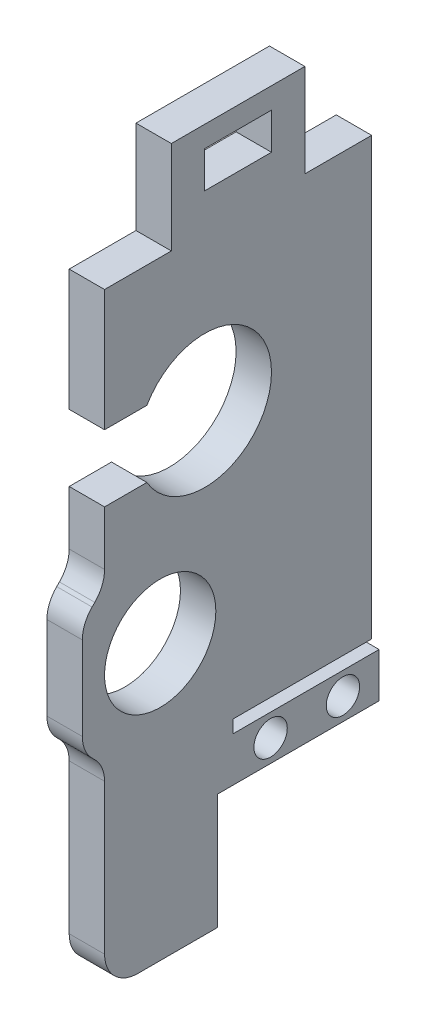
from build123d import *

# Parameters (mm, degrees)
BOSS_EXTRUDE1_DEPTH     = 3.18
SKETCH2_4_OUTSIDE_W     = 40.864
SKETCH2_4_OUTSIDE_H     = 68.924
SKETCH2_4_OUTSIDE_R     = 5
CUT_EXTRUDE2_DEPTH      = 3.18
FILLET6_R               = 3
M3_5X0_6_TAPPED_HOLE1_D = 3
SKETCH9_W               = 3.18
SKETCH9_H               = 12
BOSS_EXTRUDE2_DEPTH     = 8.36
SKETCH10_W              = 6
SKETCH10_H              = 3.28
CUT_EXTRUDE3_DEPTH      = 68.81643901


with BuildPart() as part:
    # Sketch2 → Boss-Extrude1 (new body)
    with BuildSketch(Plane(origin=(0, 0, 0), x_dir=(0, 0, -1), z_dir=(1, 0, 0))):
        with BuildLine():
            Line((0, 54.73), (24, 54.73))
            Line((24, 54.73), (24, 15.53))
            Line((24, 15.53), (11.52, 15.53))
            Line((11.52, 15.53), (11.52, 14.38))
            Line((11.52, 14.38), (24.67, 14.38))
            Line((24.67, 14.38), (24.67, 10.38))
            Line((24.67, 10.38), (10.17, 10.38))
            Line((10.17, 10.38), (10.17, 0))
            Line((10.17, 0), (0, 0))
            Line((0, 0), (0, 17.7))
            Line((0, 17.7), (-2, 19.7))
            Line((-2, 19.7), (-2, 29.7))
            Line((-2, 29.7), (0, 31.7))
            Line((0, 31.7), (0, 37.810865899))
            Line((0, 37.810865899), (3.803847577, 37.810865899))
            ThreePointArc((3.803847577, 37.810865899), (15, 40.810865899), (3.803847577, 43.810865899))
            Line((3.803847577, 43.810865899), (0, 43.810865899))
            Line((0, 43.810865899), (0, 54.73))
        make_face()
    extrude(amount=-BOSS_EXTRUDE1_DEPTH)

    # Sketch2<4> outside → Cut-Extrude2 (cut)
    # profile 1 of 2: a face of its own
    with BuildSketch(Plane(origin=(0, 0, 0), x_dir=(0, 0, -1), z_dir=(1, 0, 0))):
        with Locations((11.335, 27.365)):
            Rectangle(SKETCH2_4_OUTSIDE_W, SKETCH2_4_OUTSIDE_H)
        with BuildLine():
            Line((0, 54.73), (24, 54.73))
            Line((24, 54.73), (24, 15.53))
            Line((24, 15.53), (11.52, 15.53))
            Line((11.52, 15.53), (11.52, 14.38))
            Line((11.52, 14.38), (24.67, 14.38))
            Line((24.67, 14.38), (24.67, 10.38))
            Line((24.67, 10.38), (10.17, 10.38))
            Line((10.17, 10.38), (10.17, 0))
            Line((10.17, 0), (0, 0))
            Line((0, 0), (0, 17.7))
            Line((0, 17.7), (-2, 19.7))
            Line((-2, 19.7), (-2, 29.7))
            Line((-2, 29.7), (0, 31.7))
            Line((0, 31.7), (0, 37.810865899))
            Line((0, 37.810865899), (3.803847577, 37.810865899))
            ThreePointArc((3.803847577, 37.810865899), (15, 40.810865899), (3.803847577, 43.810865899))
            Line((3.803847577, 43.810865899), (0, 43.810865899))
            Line((0, 43.810865899), (0, 54.73))
        make_face(mode=Mode.SUBTRACT)
    # profile 2 of 2: a face of its own
    with BuildSketch(Plane(origin=(0, 0, 0), x_dir=(0, 0, -1), z_dir=(1, 0, 0))):
        with Locations((5, 24.7)):
            Circle(SKETCH2_4_OUTSIDE_R)
    extrude(amount=-CUT_EXTRUDE2_DEPTH, mode=Mode.SUBTRACT)

    # Fillet6
    fillet6_edges = [part.edges().sort_by_distance(p)[0] for p in [
        (-1.59, 31.7, 0),
        (-1.59, 29.7, 2),
        (-1.59, 19.7, 2),
        (-1.59, 17.7, 0),
        (-1.59, 0, 0),
    ]]
    fillet(fillet6_edges, radius=FILLET6_R)


with BuildPart() as body_2:
    # Mirror1: mirrored copy
    add(part.part.mirror(Plane(origin=(0, 40.810865899, -9), x_dir=(0, 0, 1), z_dir=(1, 0, 0))))

    # M3.5x0.6 Tapped Hole1 (through all)
    with Locations(Plane(origin=(3.18, 0, 0), x_dir=(0, 0, -1), z_dir=(1, 0, 0))):
        with Locations((21.42, 12.38), (14.92, 12.38)):
            Hole(M3_5X0_6_TAPPED_HOLE1_D / 2)

    # Sketch9 → Boss-Extrude2 (add)
    with BuildSketch(Plane(origin=(0, 54.73, 0), x_dir=(1, 0, 0), z_dir=(0, 1, 0))):
        with Locations((1.59, 12)):
            Rectangle(SKETCH9_W, SKETCH9_H)
    extrude(amount=BOSS_EXTRUDE2_DEPTH)

    # Sketch10 → Cut-Extrude3 (cut, through all)
    with BuildSketch(Plane(origin=(3.18, 0, 0), x_dir=(0, 0, -1), z_dir=(1, 0, 0))):
        with Locations((12, 59.55)):
            Rectangle(SKETCH10_W, SKETCH10_H)
    extrude(amount=-CUT_EXTRUDE3_DEPTH, mode=Mode.SUBTRACT)


solid = body_2.part
